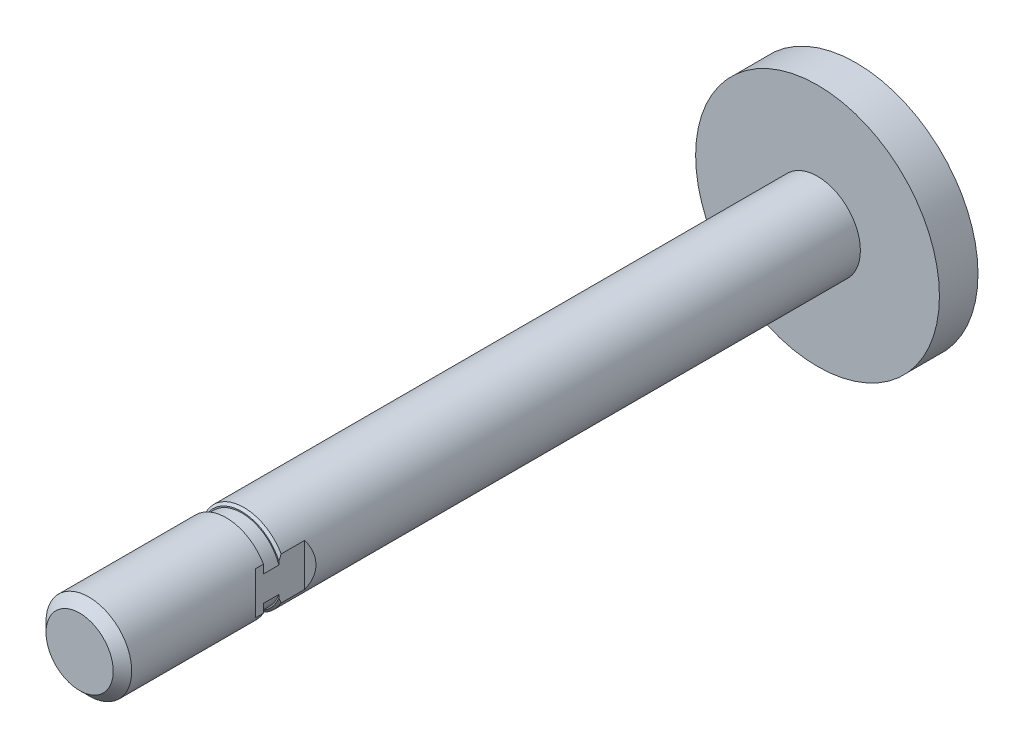
from build123d import *

# Parameters (mm, degrees)
SKETCH1_R                      = 5.556
EXTRUDE1_DEPTH                 = 100.645
THREADCHAMFER_SIZE             = 1.2
SKETCH3_OUTSIDE_W              = 33.484
SKETCH3_OUTSIDE_H              = 33.484
SKETCH3_OUTSIDE_R              = 5.1
CUT_EXTRUDE1_DEPTH             = 2
CHAMFER2_SIZE                  = 0.3
SKETCH4_R                      = 15.8
PISTON_DEPTH                   = 5
CUT_EXTRUDE2_REACH             = 105.096
CUT_EXTRUDE2_DIRECTION_2_REACH = 105.096


with BuildPart() as part:
    # Sketch1 → Extrude1 (new body)
    with BuildSketch(Plane.XY):
        with Locations(Location((0, 0, 0), (0, 0, 90))):
            Circle(SKETCH1_R)
    extrude(amount=EXTRUDE1_DEPTH)

    # ThreadChamfer
    threadchamfer_edges = [part.edges().sort_by_distance(p)[0] for p in [
        (0, -5.556, 100.645),
    ]]
    chamfer(threadchamfer_edges, length=THREADCHAMFER_SIZE)

    # Sketch3 outside → Cut-Extrude1 (cut)
    with BuildSketch(Plane.XY.offset(81.645)):
        Rectangle(SKETCH3_OUTSIDE_W, SKETCH3_OUTSIDE_H)
        Circle(SKETCH3_OUTSIDE_R, mode=Mode.SUBTRACT)
    extrude(amount=-CUT_EXTRUDE1_DEPTH, mode=Mode.SUBTRACT)

    # Chamfer2
    chamfer2_edges = [part.edges().sort_by_distance(p)[0] for p in [
        (0, -5.556, 79.645),
    ]]
    chamfer(chamfer2_edges, length=CHAMFER2_SIZE)

    # Sketch4 → Piston (add)
    with BuildSketch(Plane.XY):
        Circle(SKETCH4_R)
    extrude(amount=PISTON_DEPTH)

    # Sketch5 → Cut-Extrude2 (cut, up to next)
    with BuildSketch(Plane(origin=(0, 0, 0), x_dir=(1, 0, 0), z_dir=(0, 1, 0)), mode=Mode.PRIVATE) as cut_extrude2_sk1:
        Polygon((5.556, -75.565), (4.826, -76.295), (4.826, -82.645), (5.556, -83.375), align=None)
    cut_extrude2_tool1 = extrude(cut_extrude2_sk1.sketch, amount=-CUT_EXTRUDE2_REACH, mode=Mode.PRIVATE) & part.part
    # Sketch5 → Cut-Extrude2 (cut, up to next)
    with BuildSketch(Plane(origin=(0, 0, 0), x_dir=(1, 0, 0), z_dir=(0, 1, 0)), mode=Mode.PRIVATE) as cut_extrude2_sk2:
        Polygon((-5.556, -83.375), (-4.826, -82.645), (-4.826, -76.295), (-5.556, -75.565), align=None)
    cut_extrude2_tool2 = extrude(cut_extrude2_sk2.sketch, amount=-CUT_EXTRUDE2_REACH, mode=Mode.PRIVATE) & part.part
    add(cut_extrude2_tool1.solids().sort_by_distance((5.203545, 0, 79.47))[0], mode=Mode.SUBTRACT)
    add(cut_extrude2_tool2.solids().sort_by_distance((-5.203545, 0, 79.47))[0], mode=Mode.SUBTRACT)

    # Sketch5 → Cut-Extrude2 direction 2 (cut, up to next)
    with BuildSketch(Plane(origin=(0, 0, 0), x_dir=(1, 0, 0), z_dir=(0, 1, 0)), mode=Mode.PRIVATE) as cut_extrude2_direction_2_sk1:
        Polygon((5.556, -75.565), (4.826, -76.295), (4.826, -82.645), (5.556, -83.375), align=None)
    cut_extrude2_direction_2_tool1 = extrude(cut_extrude2_direction_2_sk1.sketch, amount=CUT_EXTRUDE2_DIRECTION_2_REACH, mode=Mode.PRIVATE) & part.part
    # Sketch5 → Cut-Extrude2 direction 2 (cut, up to next)
    with BuildSketch(Plane(origin=(0, 0, 0), x_dir=(1, 0, 0), z_dir=(0, 1, 0)), mode=Mode.PRIVATE) as cut_extrude2_direction_2_sk2:
        Polygon((-5.556, -83.375), (-4.826, -82.645), (-4.826, -76.295), (-5.556, -75.565), align=None)
    cut_extrude2_direction_2_tool2 = extrude(cut_extrude2_direction_2_sk2.sketch, amount=CUT_EXTRUDE2_DIRECTION_2_REACH, mode=Mode.PRIVATE) & part.part
    add(cut_extrude2_direction_2_tool1.solids().sort_by_distance((5.203545, 0, 79.47))[0], mode=Mode.SUBTRACT)
    add(cut_extrude2_direction_2_tool2.solids().sort_by_distance((-5.203545, 0, 79.47))[0], mode=Mode.SUBTRACT)


solid = part.part
